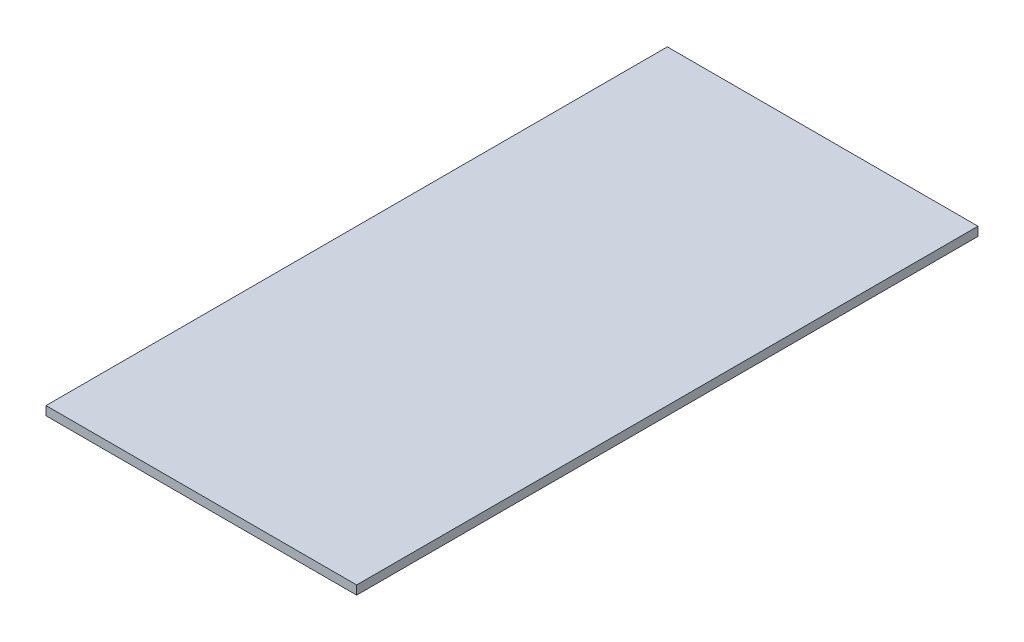
from build123d import *

# Parameters (mm, degrees)
SKETCH1_W           = 10
SKETCH1_H           = 20
BOSS_EXTRUDE1_DEPTH = 0.285


with BuildPart() as part:
    # Sketch1 → Boss-Extrude1 (new body)
    with BuildSketch(Plane(origin=(0, 0, 0), x_dir=(1, 0, 0), z_dir=(0, 1, 0))):
        Rectangle(SKETCH1_W, SKETCH1_H)
    extrude(amount=BOSS_EXTRUDE1_DEPTH)


solid = part.part
